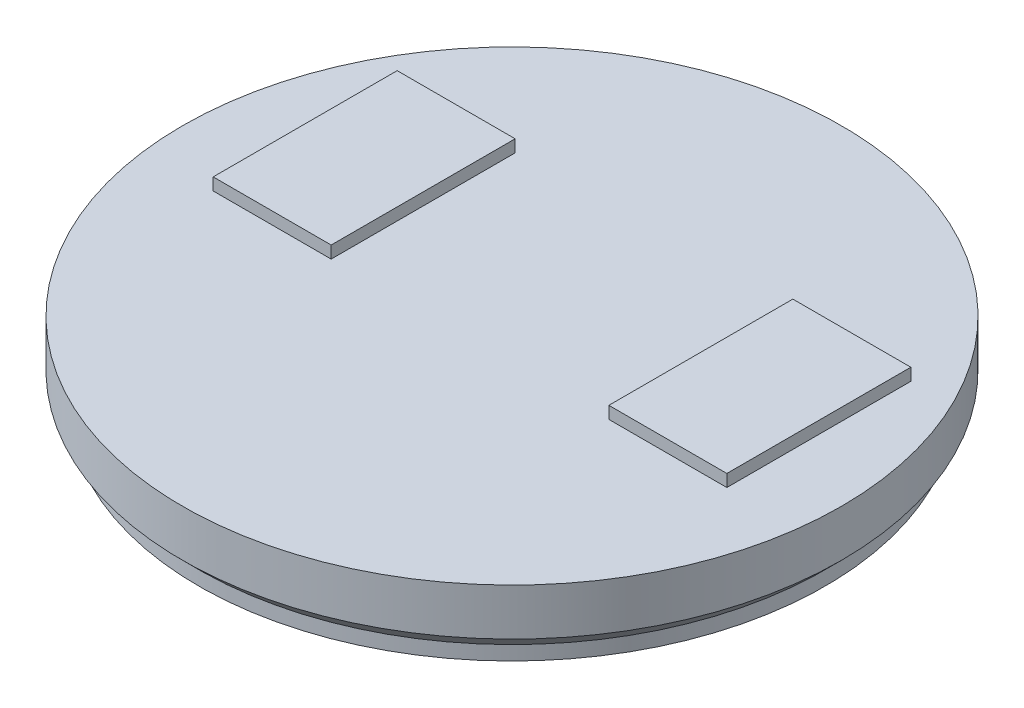
from build123d import *

# Parameters (mm, degrees)
SKETCH2_R           = 71
BOSS_EXTRUDE1_DEPTH = 11
SKETCH12_R          = 57.5
SKETCH12_R_2        = 23.75
CUT_EXTRUDE8_DEPTH  = 1
CUT_EXTRUDE9_START  = -10
SKETCH10_R          = 85
SKETCH10_R_2        = 81
CUT_EXTRUDE9_DEPTH  = 10
SKETCH14_R          = 57.5
SKETCH14_R_2        = 23.75
BOSS_EXTRUDE2_DEPTH = 1
SKETCH15_R          = 81
BOSS_EXTRUDE3_DEPTH = 4
SKETCH16_R          = 57.5
SKETCH16_R_2        = 23.75
CUT_EXTRUDE11_DEPTH = 2
SKETCH17_W          = 29
SKETCH17_H          = 10.11
SKETCH17_H_2        = 35.11
BOSS_EXTRUDE4_DEPTH = 3


with BuildPart() as part:
    # Sketch1 → Revolve1 (revolve)
    with BuildSketch(Plane.XY, mode=Mode.PRIVATE) as revolve1_sk:
        Polygon((0, 12), (0, 15), (85, 15), (85, 10.5), (84, 10.5), (77, 3.5), (77, 0), (71, 0), (71, 12), (23.75, 12), (23.75, -7.5), (21.25, -7.5), (21.25, 6), (6.5, 6), (6.5, 9), (0, 9), align=None)
    revolve(revolve1_sk.sketch.rotate(Axis((0, 12, 0), (0, -1, 0)), 180), axis=Axis((0, 12, 0), (0, -1, 0)))

    # Sketch2 → Boss-Extrude1 (add)
    with BuildSketch(Plane.XZ.offset(-12)):
        with Locations(Location((0, 0, 0), (0, 0, 180))):
            Circle(SKETCH2_R)
        Polygon((0, 70.292395274), (-60.875, 35.146197637), (-60.875, -35.146197637), (0, -70.292395274), (60.875, -35.146197637), (60.875, 35.146197637), align=None, mode=Mode.SUBTRACT)
    extrude(amount=BOSS_EXTRUDE1_DEPTH)

    # Sketch12 → Cut-Extrude8 (cut)
    with BuildSketch(Plane.XZ.offset(-12)):
        Circle(SKETCH12_R)
        with Locations(Location((0, 0, 0), (0, 0, 180))):
            Circle(SKETCH12_R_2, mode=Mode.SUBTRACT)
    extrude(amount=-CUT_EXTRUDE8_DEPTH, mode=Mode.SUBTRACT)

    # Sketch10 → Cut-Extrude9 (cut)
    with BuildSketch(Plane(origin=(0, 15, 0), x_dir=(1, 0, 0), z_dir=(0, 1, 0)).offset(CUT_EXTRUDE9_START)):
        Circle(SKETCH10_R)
        with Locations(Location((0, 0, 0), (0, 0, 180))):
            Circle(SKETCH10_R_2, mode=Mode.SUBTRACT)
    extrude(amount=CUT_EXTRUDE9_DEPTH, mode=Mode.SUBTRACT)

    # Sketch14 → Boss-Extrude2 (add)
    with BuildSketch(Plane(origin=(0, 13, 0), x_dir=(-1, 0, 0), z_dir=(0, -1, 0))):
        with Locations(Location((0, 0, 0), (0, 0, 180))):
            Circle(SKETCH14_R)
        Circle(SKETCH14_R_2, mode=Mode.SUBTRACT)
    extrude(amount=-BOSS_EXTRUDE2_DEPTH)

    # Sketch15 → Boss-Extrude3 (add)
    with BuildSketch(Plane(origin=(0, 15, 0), x_dir=(1, 0, 0), z_dir=(0, 1, 0))):
        with Locations(Location((0, 0, 0), (0, 0, 180))):
            Circle(SKETCH15_R)
    extrude(amount=BOSS_EXTRUDE3_DEPTH)

    # Sketch16 → Cut-Extrude11 (cut)
    with BuildSketch(Plane.XZ.offset(-13)):
        Circle(SKETCH16_R)
        with Locations(Location((0, 0, 0), (0, 0, 180))):
            Circle(SKETCH16_R_2, mode=Mode.SUBTRACT)
    extrude(amount=-CUT_EXTRUDE11_DEPTH, mode=Mode.SUBTRACT)

    # Sketch17 → Boss-Extrude4 (add)
    with BuildSketch(Plane(origin=(0, 19, 0), x_dir=(1, 0, 0), z_dir=(0, 1, 0))):
        with Locations((-48.833648901, -5.055)):
            Rectangle(SKETCH17_W, SKETCH17_H)
        with Locations((-48.833648901, 17.555)):
            Rectangle(SKETCH17_W, SKETCH17_H_2)
        with Locations((48.416351099, -5.055)):
            Rectangle(SKETCH17_W, SKETCH17_H)
        with Locations((48.416351099, 17.555)):
            Rectangle(SKETCH17_W, SKETCH17_H_2)
    extrude(amount=BOSS_EXTRUDE4_DEPTH)


solid = part.part
